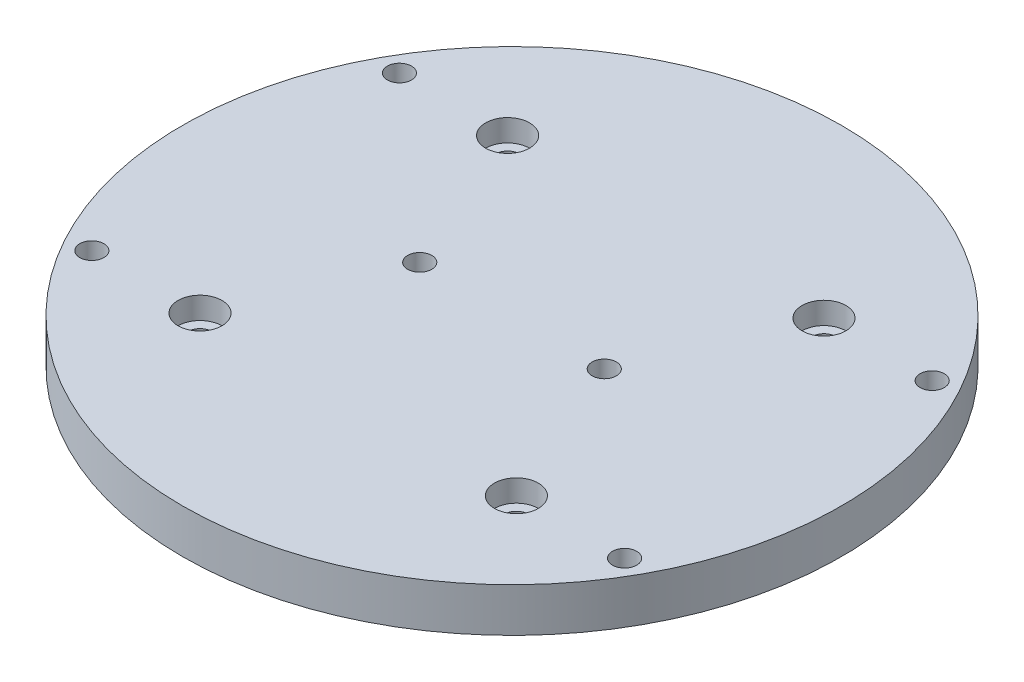
from build123d import *

# Parameters (mm, degrees)
SKETCH_1_R          = 75
EXTRUDE_1_DEPTH     = 10
SKETCH_2_R          = 2.75
CUT_EXTRUDE_1_DEPTH = 27
SKETCH_3_R          = 5
CUT_EXTRUDE_2_DEPTH = 5


with BuildPart() as part:
    # 草图1 → 凸台-拉伸1 (new body)
    with BuildSketch(Plane(origin=(0, 0, 0), x_dir=(1, 0, 0), z_dir=(0, 1, 0))):
        with Locations(Location((0, 0, 0), (0, 0, 270))):
            Circle(SKETCH_1_R)
    extrude(amount=EXTRUDE_1_DEPTH)

    # 草图2 → 切除-拉伸1 (cut)
    with BuildSketch(Plane(origin=(0, 10, 0), x_dir=(1, 0, 0), z_dir=(0, 1, 0))):
        with Locations(Location((21, 0, 0), (0, 0, 270))):
            Circle(SKETCH_2_R)
        with Locations(Location((-21, 0, 0), (0, 0, 270))):
            Circle(SKETCH_2_R)
        with Locations(Location((36, 35, 0), (0, 0, 270))):
            Circle(SKETCH_2_R)
        with Locations(Location((36, -35, 0), (0, 0, 270))):
            Circle(SKETCH_2_R)
        with Locations(Location((-36, -35, 0), (0, 0, 270))):
            Circle(SKETCH_2_R)
        with Locations(Location((-36, 35, 0), (0, 0, 270))):
            Circle(SKETCH_2_R)
        with Locations(Location((60.621778265, 35, 0), (0, 0, 270))):
            Circle(SKETCH_2_R)
        with Locations(Location((60.621778265, -35, 0), (0, 0, 270))):
            Circle(SKETCH_2_R)
        with Locations(Location((-60.621778265, -35, 0), (0, 0, 270))):
            Circle(SKETCH_2_R)
        with Locations(Location((-60.621778265, 35, 0), (0, 0, 270))):
            Circle(SKETCH_2_R)
    extrude(amount=-CUT_EXTRUDE_1_DEPTH, mode=Mode.SUBTRACT)

    # 草图3 → 切除-拉伸2 (cut)
    with BuildSketch(Plane(origin=(0, 10, 0), x_dir=(1, 0, 0), z_dir=(0, 1, 0))):
        with Locations(Location((36, 35, 0), (0, 0, 270))):
            Circle(SKETCH_3_R)
        with Locations(Location((36, -35, 0), (0, 0, 270))):
            Circle(SKETCH_3_R)
        with Locations(Location((-36, -35, 0), (0, 0, 270))):
            Circle(SKETCH_3_R)
        with Locations(Location((-36, 35, 0), (0, 0, 270))):
            Circle(SKETCH_3_R)
    extrude(amount=-CUT_EXTRUDE_2_DEPTH, mode=Mode.SUBTRACT)


solid = part.part
